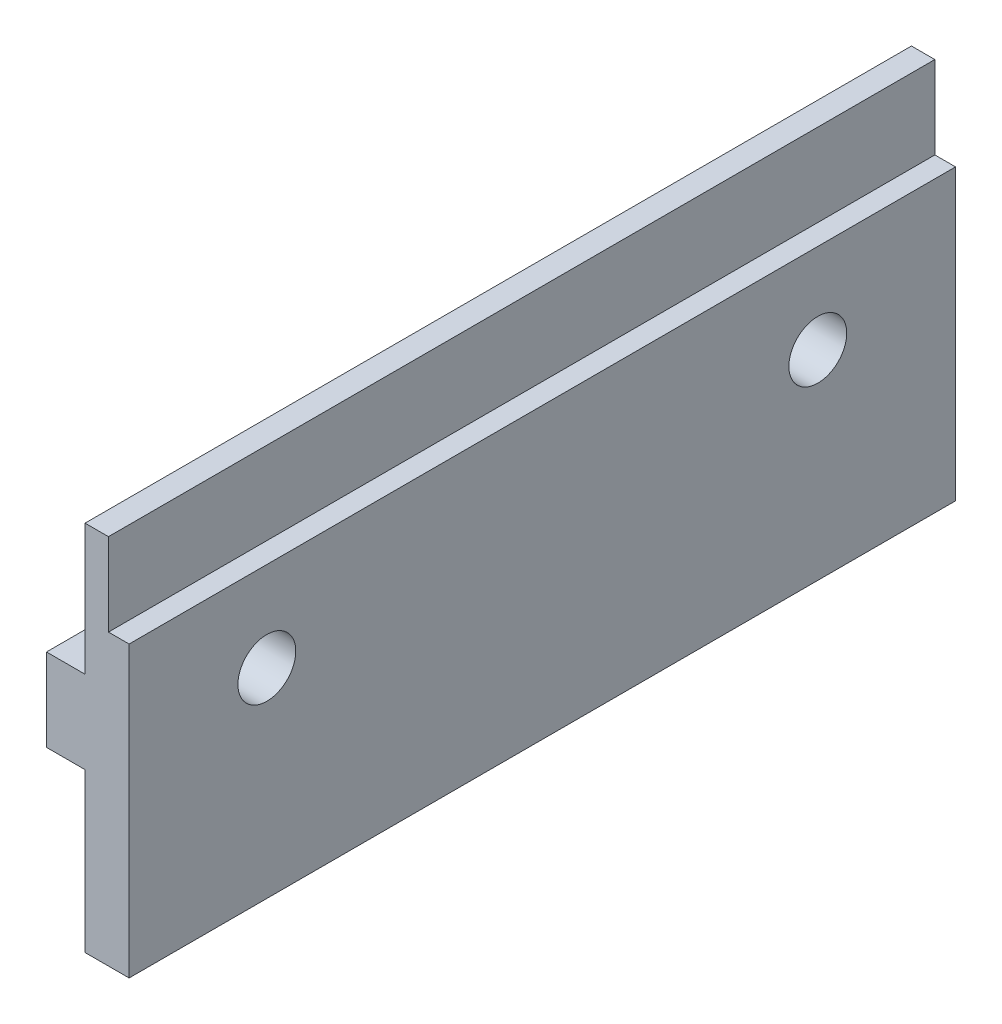
from build123d import *

# Parameters (mm, degrees)
SKETCH1_W                = 60
SKETCH1_H                = 27
BOSS_EXTRUDE1_DEPTH      = 6
CUT_EXTRUDE19_DEPTH      = 67.068146637
CUT_EXTRUDE19_DEPTH_BACK = 67.068146637
SKETCH9_W                = 2.8
SKETCH9_H                = 11.5
CUT_EXTRUDE20_DEPTH      = 67.068146637
CUT_EXTRUDE21_DEPTH      = 67.068146637
CUT_EXTRUDE21_DEPTH_BACK = 67.068146637
SKETCH10_W               = 2.8
SKETCH10_H               = 9.5
M5_TAPPED_HOLE3_D        = 4.2
M5_TAPPED_HOLE3_DEPTH    = 12.4
M5_TAPPED_HOLE3_TIP      = 1.2618073
M5_TAPPED_HOLE4_D        = 4.2
M5_TAPPED_HOLE4_DEPTH    = 12.4
M5_TAPPED_HOLE4_TIP      = 1.2618073


with BuildPart() as part:
    # Sketch1 → Boss-Extrude1 (new body)
    with BuildSketch(Plane(origin=(0, 0, 0), x_dir=(0, 0, -1), z_dir=(1, 0, 0))):
        with Locations((30, 13.5)):
            Rectangle(SKETCH1_W, SKETCH1_H)
    extrude(amount=BOSS_EXTRUDE1_DEPTH)

    # 3DSketch1 → Cut-Extrude19 (cut, two sides: drawn at the far end of the back side and taken through both)
    with BuildSketch(Plane(origin=(6, 27, 0), x_dir=(-0.24253562503633286, -0.970142500145332, 0), z_dir=(0, 0, -1)).offset(-CUT_EXTRUDE19_DEPTH_BACK)):
        Polygon((0, 0), (0.363803438, 1.45521375), (6.184658438, 0), (5.820855001, -1.45521375), align=None)
    extrude(amount=CUT_EXTRUDE19_DEPTH + CUT_EXTRUDE19_DEPTH_BACK, mode=Mode.SUBTRACT)

    # Sketch9 → Cut-Extrude20 (cut, through all)
    with BuildSketch(Plane(origin=(0, 0, -60), x_dir=(-1, 0, 0), z_dir=(0, 0, -1))):
        with Locations((-1.4, 5.75)):
            Rectangle(SKETCH9_W, SKETCH9_H)
    extrude(amount=-CUT_EXTRUDE20_DEPTH, mode=Mode.SUBTRACT)

    # Sketch10 → Cut-Extrude21 (cut, two sides: drawn at the far end of the back side and taken through both)
    with BuildSketch(Plane(origin=(0, 0, -60), x_dir=(-1, 0, 0), z_dir=(0, 0, -1)).offset(-CUT_EXTRUDE21_DEPTH_BACK)):
        with Locations((-1.4, 22.25)):
            Rectangle(SKETCH10_W, SKETCH10_H)
    extrude(amount=CUT_EXTRUDE21_DEPTH + CUT_EXTRUDE21_DEPTH_BACK, mode=Mode.SUBTRACT)

    # M5 Tapped Hole3
    with Locations(Plane(origin=(0, 14.5, -50), x_dir=(0, 0, -1), z_dir=(-1, 0, 0))):
        with Locations((0, 0)):
            Hole(M5_TAPPED_HOLE3_D / 2, depth=M5_TAPPED_HOLE3_DEPTH)
            with Locations((0, 0, -(M5_TAPPED_HOLE3_DEPTH + M5_TAPPED_HOLE3_TIP / 2))):  # 118° drill point
                Cone(0, M5_TAPPED_HOLE3_D / 2, M5_TAPPED_HOLE3_TIP, mode=Mode.SUBTRACT)

    # M5 Tapped Hole4
    with Locations(Plane(origin=(0, 14.5, -10), x_dir=(0, 0, -1), z_dir=(-1, 0, 0))):
        with Locations((0, 0)):
            Hole(M5_TAPPED_HOLE4_D / 2, depth=M5_TAPPED_HOLE4_DEPTH)
            with Locations((0, 0, -(M5_TAPPED_HOLE4_DEPTH + M5_TAPPED_HOLE4_TIP / 2))):  # 118° drill point
                Cone(0, M5_TAPPED_HOLE4_D / 2, M5_TAPPED_HOLE4_TIP, mode=Mode.SUBTRACT)


solid = part.part
